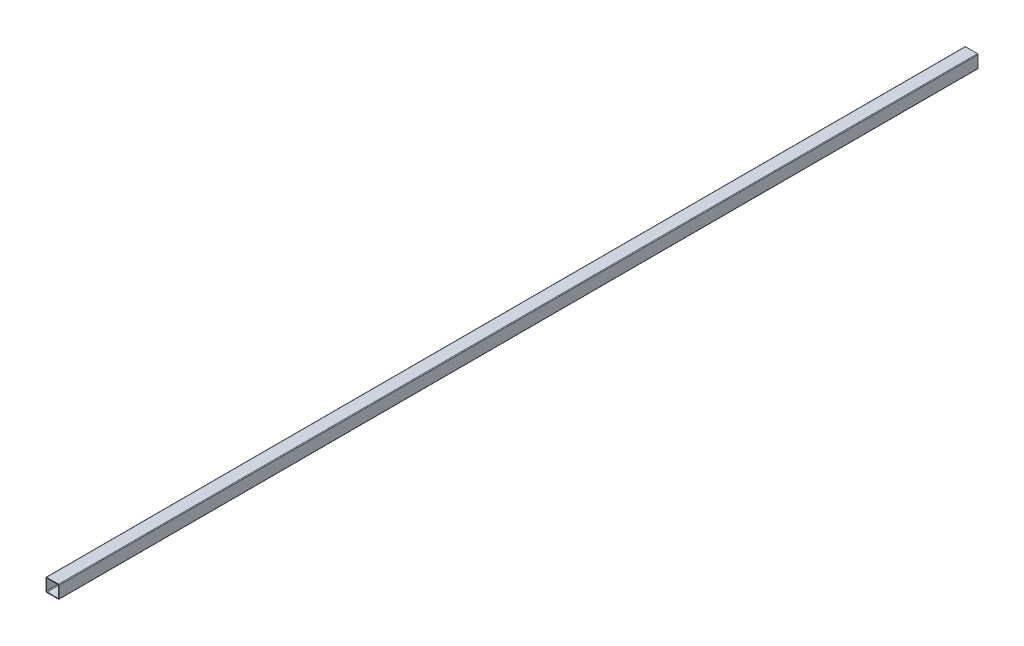
from build123d import *

# Parameters (mm, degrees)
EXTRUDE_1_DEPTH = 2800


with BuildPart() as part:
    # Эскиз1 → Бобышка-Вытянуть1 (new body)
    with BuildSketch(Plane.XY):
        with BuildLine():
            Line((18, -20), (-18, -20))
            ThreePointArc((-18, -20), (-19.414213562, -19.414213562), (-20, -18))
            Line((-20, -18), (-20, 18))
            ThreePointArc((-20, 18), (-19.414213562, 19.414213562), (-18, 20))
            Line((-18, 20), (18, 20))
            ThreePointArc((18, 20), (19.414213562, 19.414213562), (20, 18))
            Line((20, 18), (20, -18))
            ThreePointArc((20, -18), (19.414213562, -19.414213562), (18, -20))
        make_face()
        with BuildLine():
            Line((16, -18), (-16, -18))
            ThreePointArc((-16, -18), (-17.414213562, -17.414213562), (-18, -16))
            Line((-18, -16), (-18, 16))
            ThreePointArc((-18, 16), (-17.414213562, 17.414213562), (-16, 18))
            Line((-16, 18), (16, 18))
            ThreePointArc((16, 18), (17.414213562, 17.414213562), (18, 16))
            Line((18, 16), (18, -16))
            ThreePointArc((18, -16), (17.414213562, -17.414213562), (16, -18))
        make_face(mode=Mode.SUBTRACT)
    extrude(amount=EXTRUDE_1_DEPTH)


solid = part.part
